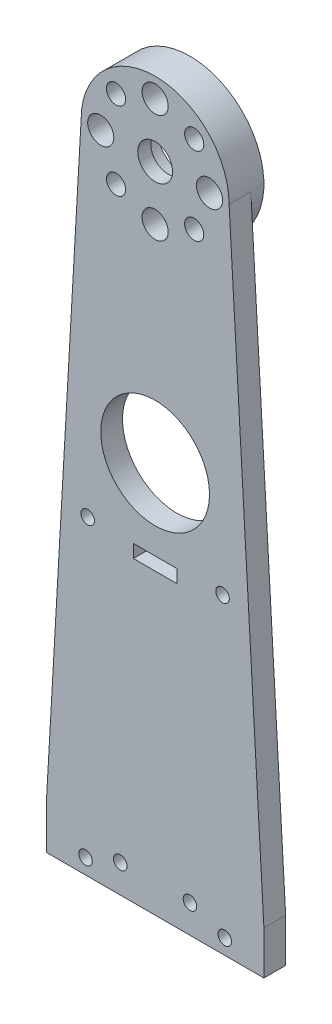
from build123d import *
from build123d.topology import SkipClean

# Parameters (mm, degrees)
SKETCH1_R           = 4
SKETCH1_R_2         = 12.5
SKETCH1_R_3         = 1.55
SKETCH1_W           = 10
SKETCH1_H           = 3
BOSS_EXTRUDE1_DEPTH = 5
BOSS_EXTRUDE2_START = 3
SKETCH2_R           = 17
BOSS_EXTRUDE2_DEPTH = 3
SKETCH3_R           = 1.55
SKETCH3_R_2         = 1
CUT_EXTRUDE1_DEPTH  = 8
SKETCH4_R           = 3
SKETCH4_R_2         = 2.2
CUT_EXTRUDE2_DEPTH  = 4.5
SKETCH5_R           = 8
CUT_EXTRUDE3_DEPTH  = 5


with BuildPart() as part:
    # Sketch1 → Boss-Extrude1 (new body)
    with BuildSketch(Plane.XY):
        with BuildLine():
            Line((-25, 0), (25, 0))
            Line((25, 0), (25, 10))
            Line((25, 10), (17, 150))
            ThreePointArc((17, 150), (0, 167), (-17, 150))
            Line((-17, 150), (-25, 10))
            Line((-25, 10), (-25, 0))
        make_face()
        with Locations((0, 150)):
            Circle(SKETCH1_R, mode=Mode.SUBTRACT)
        with Locations((0, 90)):
            Circle(SKETCH1_R_2, mode=Mode.SUBTRACT)
        with Locations((-8, 6.5)):
            Circle(SKETCH1_R_3, mode=Mode.SUBTRACT)
        with Locations((-16, 3.5)):
            Circle(SKETCH1_R_3, mode=Mode.SUBTRACT)
        with Locations((8, 6.5)):
            Circle(SKETCH1_R_3, mode=Mode.SUBTRACT)
        with Locations((16, 3.5)):
            Circle(SKETCH1_R_3, mode=Mode.SUBTRACT)
        with Locations((-15.5, 71.5)):
            Circle(SKETCH1_R_3, mode=Mode.SUBTRACT)
        with Locations((15.5, 71.5)):
            Circle(SKETCH1_R_3, mode=Mode.SUBTRACT)
        with Locations((0, 70)):
            Rectangle(SKETCH1_W, SKETCH1_H, mode=Mode.SUBTRACT)
    extrude(amount=BOSS_EXTRUDE1_DEPTH)

    # Sketch2 → Boss-Extrude2 (add)
    with SkipClean():  # the faces are left unmerged after this step: merging them gives an invalid solid
        with BuildSketch(Plane(origin=(0, 0, 0), x_dir=(-1, 0, 0), z_dir=(0, 0, -1)).offset(BOSS_EXTRUDE2_START)):
            with Locations((0, 150)):
                Circle(SKETCH2_R)
        extrude(amount=-BOSS_EXTRUDE2_DEPTH)

    # Sketch3 → Cut-Extrude1 (cut)
    with SkipClean():  # the faces are left unmerged after this step: merging them gives an invalid solid
        with BuildSketch(Plane.XY.offset(5)):
            with Locations((-12.5, 150)):
                Circle(SKETCH3_R)
            with Locations((0, 162.5)):
                Circle(SKETCH3_R)
            with Locations((12.5, 150)):
                Circle(SKETCH3_R)
            with Locations((0, 137.5)):
                Circle(SKETCH3_R)
            with Locations((8.980256121, 158.980256121)):
                Circle(SKETCH3_R_2)
            with Locations((8.980256121, 141.019743879)):
                Circle(SKETCH3_R_2)
            with Locations((-8.980256121, 141.019743879)):
                Circle(SKETCH3_R_2)
            with Locations((-8.980256121, 158.980256121)):
                Circle(SKETCH3_R_2)
        extrude(amount=-CUT_EXTRUDE1_DEPTH, mode=Mode.SUBTRACT)

    # Sketch4 → Cut-Extrude2 (cut)
    with SkipClean():  # the faces are left unmerged after this step: merging them gives an invalid solid
        with BuildSketch(Plane.XY.offset(5)):
            with Locations((-12.5, 150)):
                Circle(SKETCH4_R)
            with Locations((0, 162.5)):
                Circle(SKETCH4_R)
            with Locations((12.5, 150)):
                Circle(SKETCH4_R)
            with Locations((0, 137.5)):
                Circle(SKETCH4_R)
            with Locations((-8.980256121, 158.980256121)):
                Circle(SKETCH4_R_2)
            with Locations((8.980256121, 158.980256121)):
                Circle(SKETCH4_R_2)
            with Locations((8.980256121, 141.019743879)):
                Circle(SKETCH4_R_2)
            with Locations((-8.980256121, 141.019743879)):
                Circle(SKETCH4_R_2)
        extrude(amount=-CUT_EXTRUDE2_DEPTH, mode=Mode.SUBTRACT)

    # Sketch5 → Cut-Extrude3 (cut)
    with SkipClean():  # the faces are left unmerged after this step: merging them gives an invalid solid
        with BuildSketch(Plane(origin=(0, 0, -3), x_dir=(-1, 0, 0), z_dir=(0, 0, -1))):
            with Locations((0, 150)):
                Circle(SKETCH5_R)
        extrude(amount=-CUT_EXTRUDE3_DEPTH, mode=Mode.SUBTRACT)


solid = part.part
